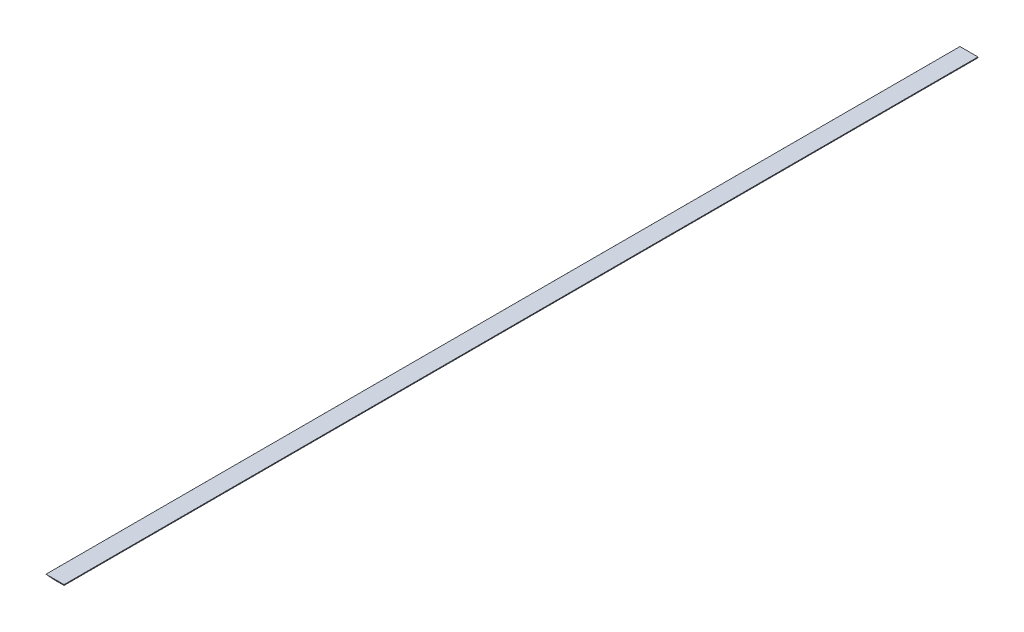
from build123d import *

# Parameters (mm, degrees)
BOSS_EXTRUDE1_DEPTH = 5000
FILLET1_R           = 0.127


with BuildPart() as part:
    # Sketch1 → Boss-Extrude1 (new body)
    with BuildSketch(Plane.XY):
        Polygon((0, 0), (53.975, 0), (53.975, 4.1666476), (-47.625, 4.1666476), align=None)
    extrude(amount=BOSS_EXTRUDE1_DEPTH)

    # Fillet1
    fillet1_edges = [part.edges().sort_by_distance(p)[0] for p in [
        (-47.625, 4.1666476, 2500),
    ]]
    fillet(fillet1_edges, radius=FILLET1_R)


solid = part.part
